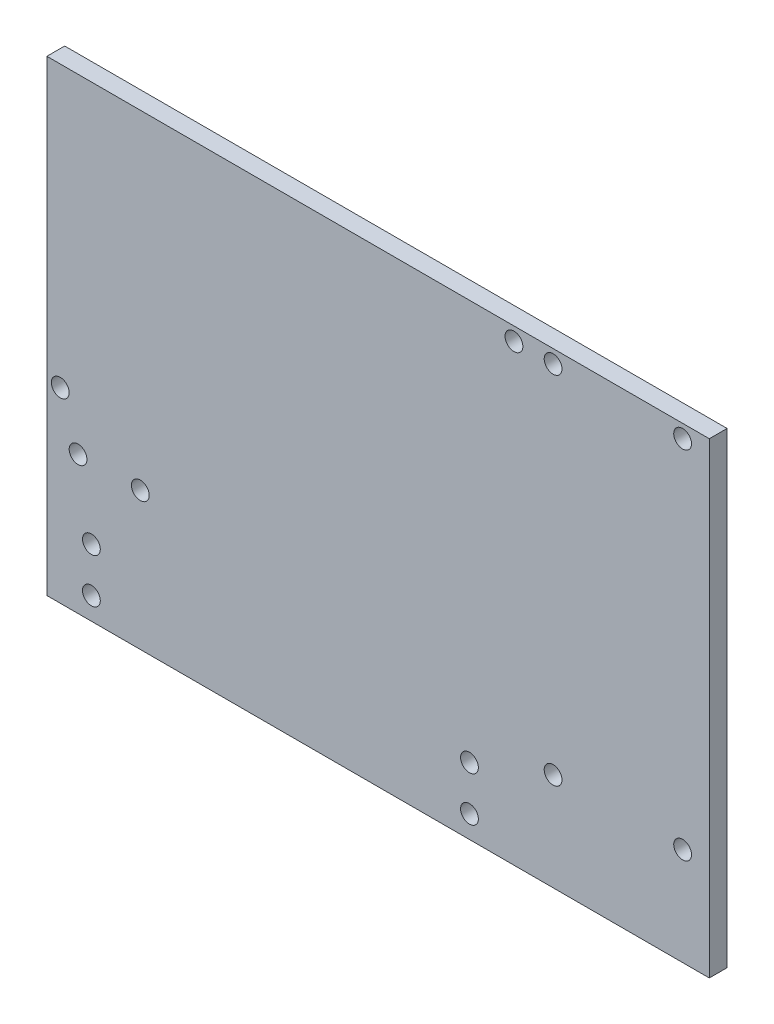
from build123d import *

# Parameters (mm, degrees)
SKETCH2_W           = 74.46
SKETCH2_H           = 52.500000064
SKETCH2_R           = 1
BOSS_EXTRUDE1_DEPTH = 2


with BuildPart() as part:
    # Sketch2 → Boss-Extrude1 (new body)
    with BuildSketch(Plane.XY):
        with Locations((51.585490461, 10.250000032)):
            Rectangle(SKETCH2_W, SKETCH2_H)
        with Locations((66.855490461, 35.000000064)):
            Circle(SKETCH2_R, mode=Mode.SUBTRACT)
        with Locations((15.855490461, 5.000000064)):
            Circle(SKETCH2_R, mode=Mode.SUBTRACT)
        with Locations((85.815490461, 35.000000064)):
            Circle(SKETCH2_R, mode=Mode.SUBTRACT)
        with Locations((85.815490461, -5.000000191)):
            Circle(SKETCH2_R, mode=Mode.SUBTRACT)
        with BuildLine():
            ThreePointArc((71.255490461, -4.000000191), (70.255490461, -5.000000191), (71.255490461, -6.000000191))
            ThreePointArc((71.255490461, -6.000000191), (72.255490461, -5.000000191), (71.255490461, -4.000000191))
        make_face(mode=Mode.SUBTRACT)
        with BuildLine():
            ThreePointArc((18.355490461, -13.5), (19.355490461, -14.5), (20.355490461, -13.5))
            ThreePointArc((20.355490461, -13.5), (19.355490461, -12.5), (18.355490461, -13.5))
        make_face(mode=Mode.SUBTRACT)
        with BuildLine():
            ThreePointArc((18.355490461, -8.5), (19.355490461, -9.5), (20.355490461, -8.5))
            ThreePointArc((20.355490461, -8.5), (19.355490461, -7.5), (18.355490461, -8.5))
        make_face(mode=Mode.SUBTRACT)
        with BuildLine():
            ThreePointArc((17.855490461, 0.500000064), (16.855490461, -0.499999936), (17.855490461, -1.499999936))
            ThreePointArc((17.855490461, -1.499999936), (18.855490461, -0.499999936), (17.855490461, 0.500000064))
        make_face(mode=Mode.SUBTRACT)
        with BuildLine():
            ThreePointArc((24.855490461, 0.500000064), (23.855490461, -0.499999936), (24.855490461, -1.499999936))
            ThreePointArc((24.855490461, -1.499999936), (25.855490461, -0.499999936), (24.855490461, 0.500000064))
        make_face(mode=Mode.SUBTRACT)
        with BuildLine():
            ThreePointArc((60.855490461, -13.5), (61.855490461, -14.5), (62.855490461, -13.5))
            ThreePointArc((62.855490461, -13.5), (61.855490461, -12.5), (60.855490461, -13.5))
        make_face(mode=Mode.SUBTRACT)
        with BuildLine():
            ThreePointArc((62.855490461, -8.5), (61.855490461, -7.5), (60.855490461, -8.5))
            ThreePointArc((60.855490461, -8.5), (61.855490461, -9.5), (62.855490461, -8.5))
        make_face(mode=Mode.SUBTRACT)
        with BuildLine():
            ThreePointArc((71.255490461, 34.000000064), (72.255490461, 35.000000064), (71.255490461, 36.000000064))
            ThreePointArc((71.255490461, 36.000000064), (70.255490461, 35.000000064), (71.255490461, 34.000000064))
        make_face(mode=Mode.SUBTRACT)
    extrude(amount=BOSS_EXTRUDE1_DEPTH)


solid = part.part
